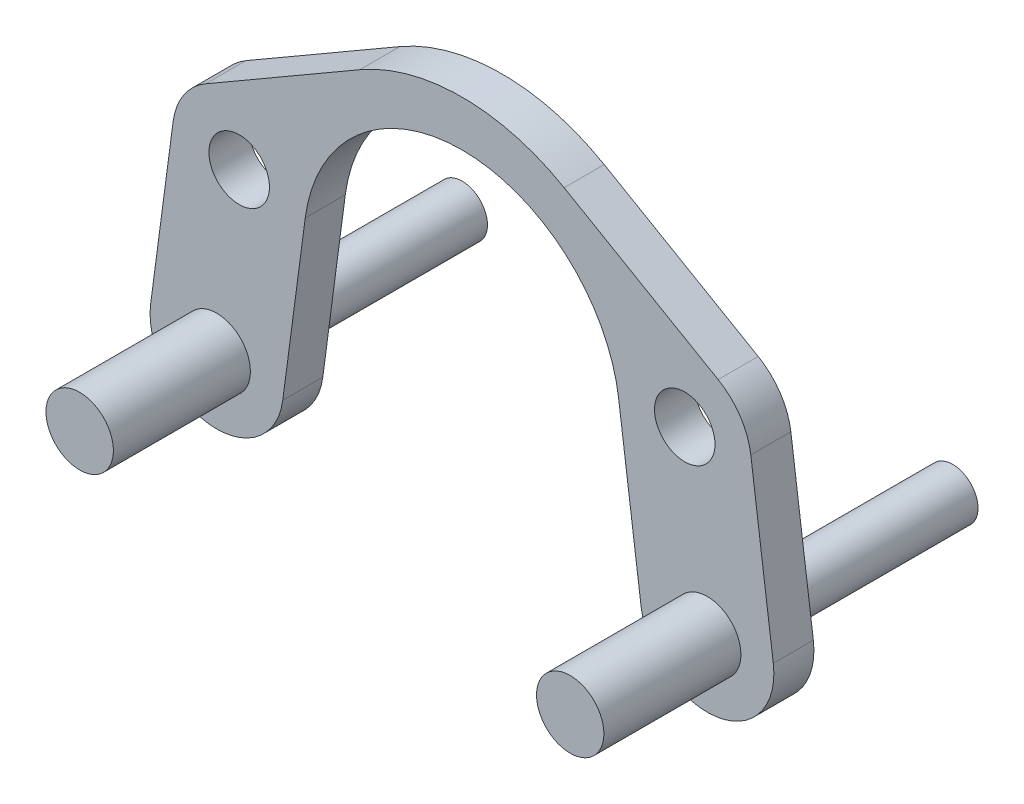
from build123d import *

# Parameters (mm, degrees)
SKETCH1_R           = 4.699
BOSS_EXTRUDE1_DEPTH = 6.223
SKETCH2_R           = 5.2324
BOSS_EXTRUDE2_DEPTH = 21.2852
SKETCH3_R           = 3.937
BOSS_EXTRUDE3_DEPTH = 31.9024


with BuildPart() as part:
    # Sketch1 → Boss-Extrude1 (new body)
    with BuildSketch(Plane.XY):
        with BuildLine():
            Line((27.839647422, -1.363090318), (24.347147422, 24.925909682))
            ThreePointArc((24.347147422, 24.925909682), (16.183361565, 40.166897281), (0, 46.252446639))
            ThreePointArc((0, 46.252446639), (-16.183361565, 40.166897281), (-24.347147422, 24.925909682))
            Line((-24.347147422, 24.925909682), (-27.839647422, -1.363090318))
            ThreePointArc((-27.839647422, -1.363090318), (-39.463090318, -10.260352578), (-48.360352578, 1.363090318))
            Line((-48.360352578, 1.363090318), (-44.867852578, 27.652090318))
            ThreePointArc((-44.867852578, 27.652090318), (-43.214104666, 32.038713591), (-39.794788795, 35.245834553))
            Line((-39.794788795, 35.245834553), (-15.873370018, 49.099758822))
            ThreePointArc((-15.873370018, 49.099758822), (0, 53.364446639), (15.873370018, 49.099758822))
            Line((15.873370018, 49.099758822), (39.794788795, 35.245834553))
            ThreePointArc((39.794788795, 35.245834553), (43.214104666, 32.038713591), (44.867852578, 27.652090318))
            Line((44.867852578, 27.652090318), (48.360352578, 1.363090318))
            ThreePointArc((48.360352578, 1.363090318), (39.463090318, -10.260352578), (27.839647422, -1.363090318))
        make_face()
        with Locations((34.6075, 26.289)):
            Circle(SKETCH1_R, mode=Mode.SUBTRACT)
        with Locations(Location((-34.6075, 26.289, 0), (0, 0, 180))):
            Circle(SKETCH1_R, mode=Mode.SUBTRACT)
    extrude(amount=BOSS_EXTRUDE1_DEPTH)

    # Sketch2 → Boss-Extrude2 (add)
    with BuildSketch(Plane.XY.offset(6.223)):
        with Locations((38.1, 0)):
            Circle(SKETCH2_R)
    boss_extrude2 = extrude(amount=BOSS_EXTRUDE2_DEPTH)

    # Mirror1: Boss-Extrude2 across plane
    add(boss_extrude2.mirror(Plane(origin=(0, 0, 0), x_dir=(0, 0, 1), z_dir=(1, 0, 0))))

    # Sketch3 → Boss-Extrude3 (add)
    with BuildSketch(Plane(origin=(0, 0, 0), x_dir=(-1, 0, 0), z_dir=(0, 0, -1))):
        with Locations(Location((38.1, 0, 0), (0, 0, 180))):
            Circle(SKETCH3_R)
    boss_extrude3 = extrude(amount=BOSS_EXTRUDE3_DEPTH)

    # Mirror2: Boss-Extrude3 across plane
    add(boss_extrude3.mirror(Plane(origin=(0, 0, 0), x_dir=(0, 0, 1), z_dir=(1, 0, 0))))


solid = part.part
